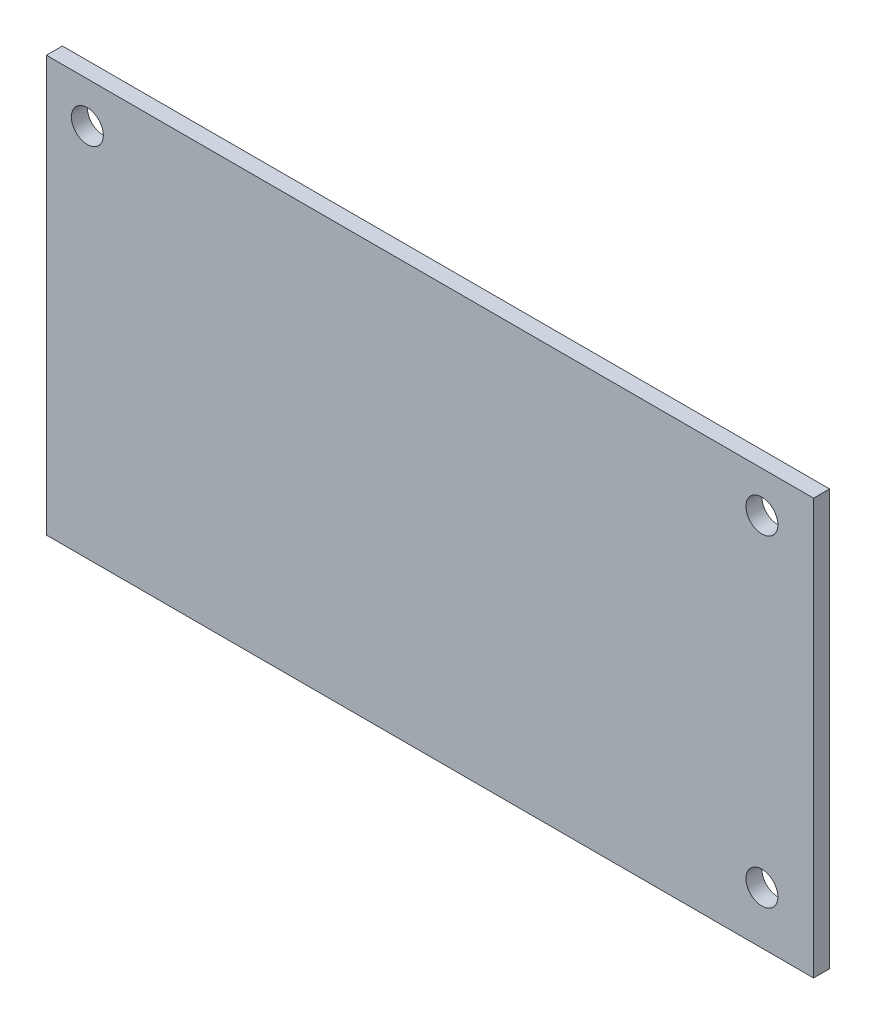
from build123d import *

# Parameters (mm, degrees)
SKETCH1_W           = 76.2
SKETCH1_H           = 41.275
SKETCH1_R           = 1.5875
BOSS_EXTRUDE1_DEPTH = 1.5875


with BuildPart() as part:
    # Sketch1 → Boss-Extrude1 (new body)
    with BuildSketch(Plane.XY):
        with Locations((38.1, 20.6375)):
            Rectangle(SKETCH1_W, SKETCH1_H)
        with Locations((4.064, 37.211)):
            Circle(SKETCH1_R, mode=Mode.SUBTRACT)
        with Locations((71.064, 37.211)):
            Circle(SKETCH1_R, mode=Mode.SUBTRACT)
        with Locations((71.064, 5.207)):
            Circle(SKETCH1_R, mode=Mode.SUBTRACT)
    extrude(amount=BOSS_EXTRUDE1_DEPTH)


solid = part.part
